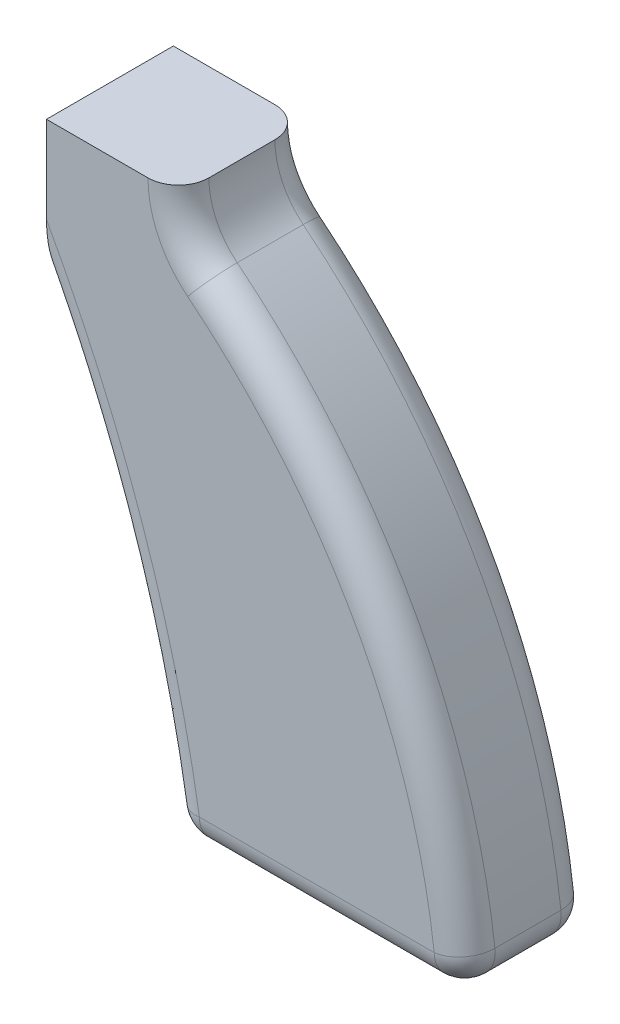
from build123d import *

# Parameters (mm, degrees)
EXTRUDE_1_DEPTH = 12.5
FILLET_1_R      = 6


with BuildPart() as part:
    # 草图1 → 凸台-拉伸1 (new, symmetric)
    with BuildSketch(Plane.XY):
        with BuildLine():
            Line((0, 0), (26, 0))
            ThreePointArc((26, 0), (27.468456661, -6.472815065), (31.586311315, -11.678290343))
            ThreePointArc((31.586311315, -11.678290343), (67.528745318, -55.48682347), (83, -110))
            Line((83, -110), (25, -110))
            ThreePointArc((25, -110), (15.68286649, -69.005354222), (0, -30))
            Line((0, -30), (0, 0))
        make_face()
    extrude(amount=EXTRUDE_1_DEPTH, both=True)

    # 圆角1
    fillet_1_edges = [part.edges().sort_by_distance(p)[0] for p in [
        (83, -110, 0),
        (25, -110, 0),
        (54, -110, 12.5),
        (67.528745318, -55.48682347, 12.5),
        (27.468456661, -6.472815065, 12.5),
        (27.468456661, -6.472815065, -12.5),
        (67.528745318, -55.48682347, -12.5),
        (54, -110, -12.5),
        (15.68286649, -69.005354222, -12.5),
        (15.68286649, -69.005354222, 12.5),
    ]]
    fillet(fillet_1_edges, radius=FILLET_1_R)


solid = part.part
